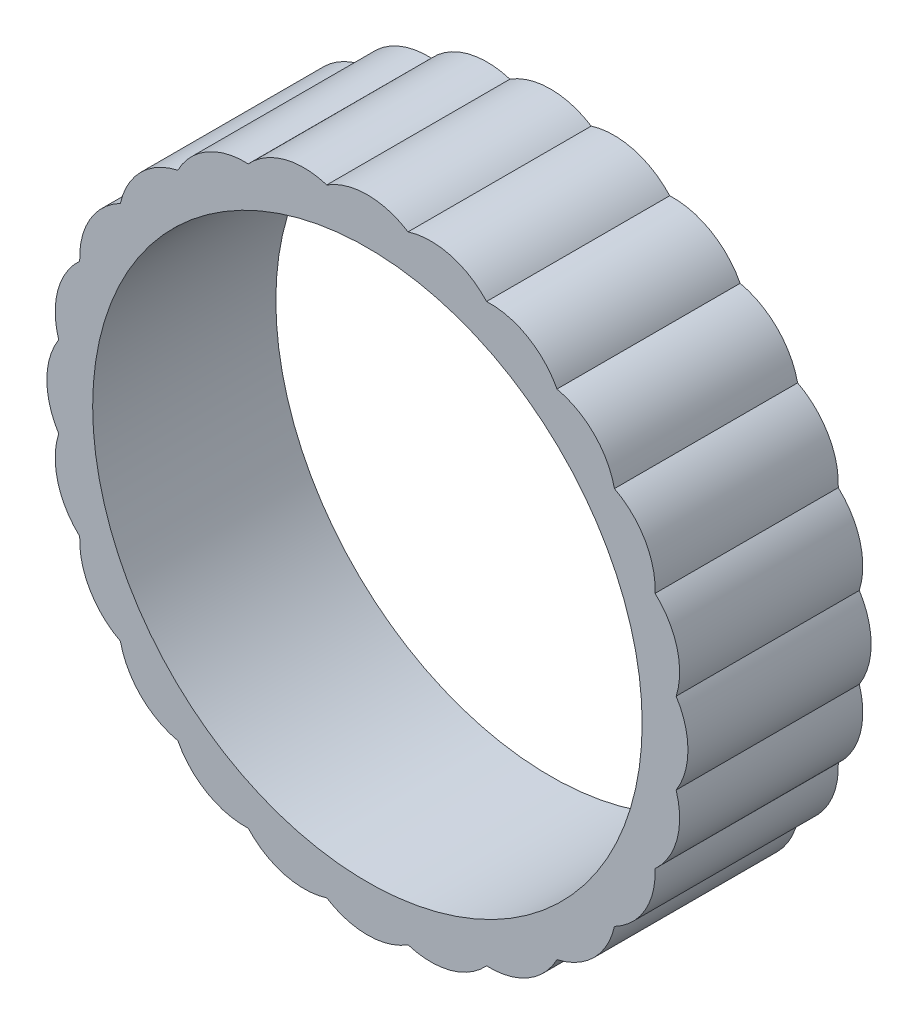
from build123d import *

# Parameters (mm, degrees)
SKETCH1_R           = 17
SKETCH1_R_2         = 15
BOSS_EXTRUDE1_DEPTH = 10
BOSS_EXTRUDE2_START = -10
BOSS_EXTRUDE2_DEPTH = 10
CIRPATTERN1_COUNT   = 24


with BuildPart() as part:
    # Sketch1 → Boss-Extrude1 (new body)
    with BuildSketch(Plane.XY):
        Circle(SKETCH1_R)
        Circle(SKETCH1_R_2, mode=Mode.SUBTRACT)
    extrude(amount=BOSS_EXTRUDE1_DEPTH)

    # Sketch2 → Boss-Extrude2 (add)
    with BuildSketch(Plane.XY.offset(10).offset(BOSS_EXTRUDE2_START)):
        with BuildLine():
            ThreePointArc((-2.218945268, 16.854562643), (0, 17.5), (2.218945268, 16.854562643))
            ThreePointArc((2.218945268, 16.854562643), (0, 17), (-2.218945268, 16.854562643))
        make_face()
    boss_extrude2 = extrude(amount=BOSS_EXTRUDE2_DEPTH)

    # CirPattern1: Boss-Extrude2 ×24 about axis
    cirpattern1_axis = Axis((0, 0, 0), (0, 0, 1))
    for i in range(1, CIRPATTERN1_COUNT):
        add(boss_extrude2.rotate(cirpattern1_axis, i * 360 / CIRPATTERN1_COUNT))


solid = part.part
